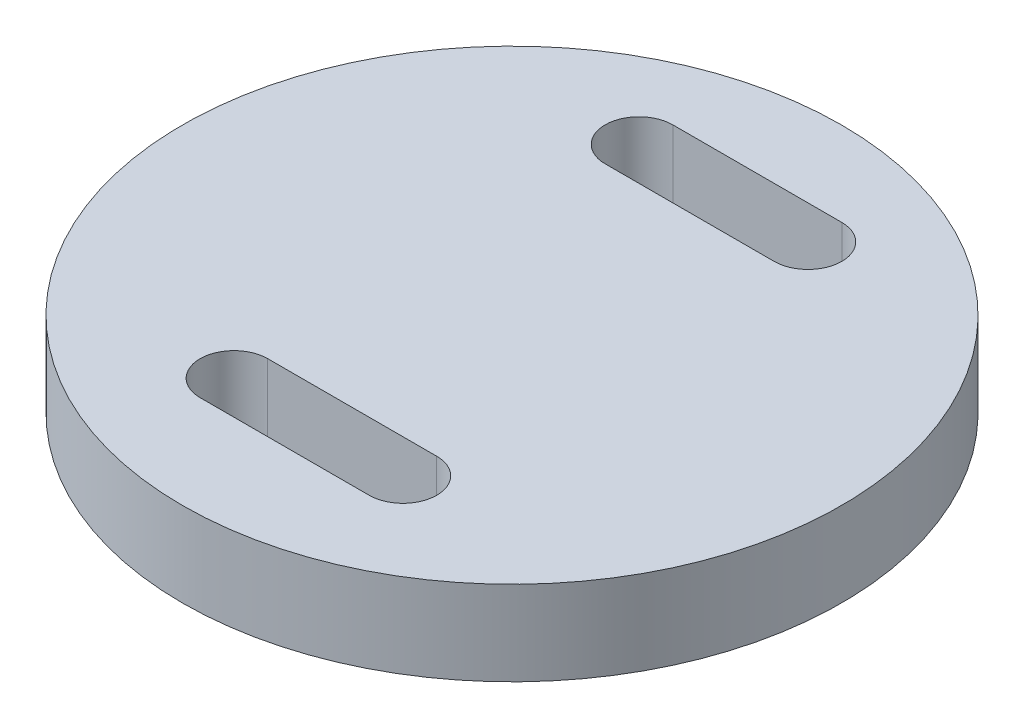
from build123d import *

# Parameters (mm, degrees)
SKETCH1_R           = 49.53
BOSS_EXTRUDE1_DEPTH = 12.7
CUT_EXTRUDE1_DEPTH  = 72.188003203


with BuildPart() as part:
    # Sketch1 → Boss-Extrude1 (new body)
    with BuildSketch(Plane(origin=(0, 0, 0), x_dir=(1, 0, 0), z_dir=(0, 1, 0))):
        with Locations(Location((0, 0, 0), (0, 0, 270))):
            Circle(SKETCH1_R)
    extrude(amount=BOSS_EXTRUDE1_DEPTH)

    # Sketch2 → Cut-Extrude1 (cut, through all)
    with BuildSketch(Plane(origin=(0, 12.7, 0), x_dir=(1, 0, 0), z_dir=(0, 1, 0))):
        with BuildLine():
            Line((12.7, -34.169941281), (-12.7, -34.169941281))
            ThreePointArc((-12.7, -34.169941281), (-17.78, -29.089941281), (-12.7, -24.009941281))
            Line((-12.7, -24.009941281), (12.7, -24.009941281))
            ThreePointArc((12.7, -24.009941281), (17.78, -29.089941281), (12.7, -34.169941281))
        make_face()
        with BuildLine():
            Line((-12.7, 36.864035983), (12.7, 36.864035983))
            ThreePointArc((12.7, 36.864035983), (17.78, 31.784035983), (12.7, 26.704035983))
            Line((12.7, 26.704035983), (-12.7, 26.704035983))
            ThreePointArc((-12.7, 26.704035983), (-17.78, 31.784035983), (-12.7, 36.864035983))
        make_face()
    extrude(amount=-CUT_EXTRUDE1_DEPTH, mode=Mode.SUBTRACT)


solid = part.part
